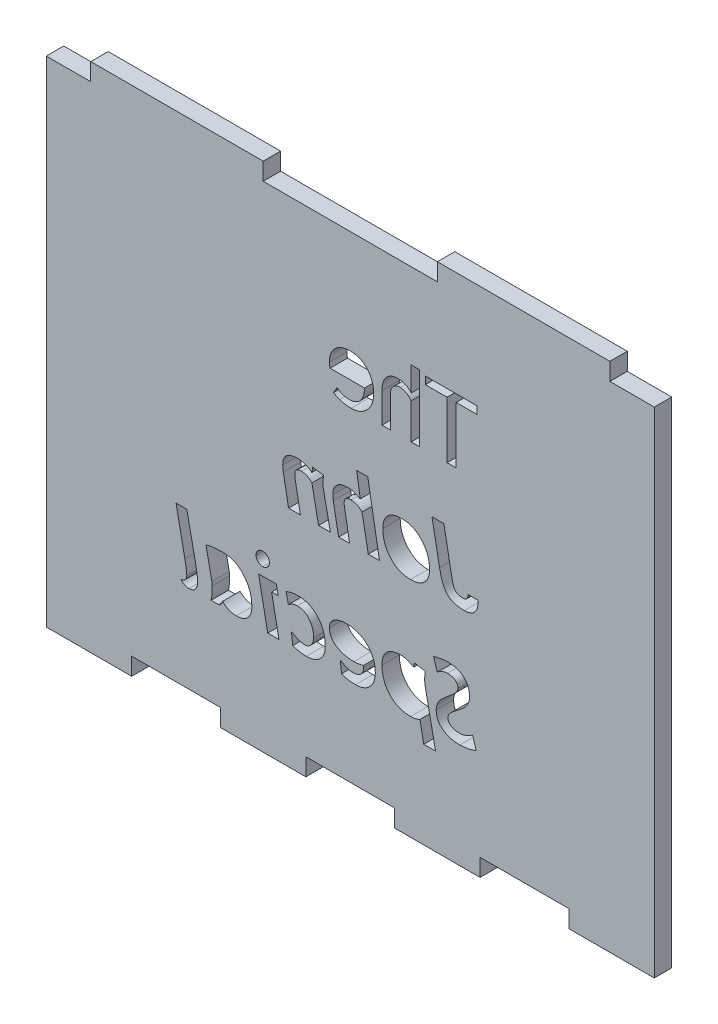
from build123d import *

# Parameters (mm, degrees)
SKETCH1_W           = 88.646
SKETCH1_H           = 72.10044
BOSS_EXTRUDE1_DEPTH = 2.54
SKETCH2_W           = 25.146
SKETCH2_H           = 2.54
BOSS_EXTRUDE2_DEPTH = 2.54
CUT_EXTRUDE2_DEPTH  = 59.823337279
SKETCH4_W           = 12.954
SKETCH4_H           = 2.54
CUT_EXTRUDE3_DEPTH  = 59.823337424


with BuildPart() as part:
    # Sketch1 → Boss-Extrude1 (new body)
    with BuildSketch(Plane.XY):
        Rectangle(SKETCH1_W, SKETCH1_H)
    extrude(amount=BOSS_EXTRUDE1_DEPTH)

    # Sketch2 → Boss-Extrude2 (add)
    with BuildSketch(Plane.XY.offset(2.54)):
        with Locations((-25.273, 37.32022)):
            Rectangle(SKETCH2_W, SKETCH2_H)
    boss_extrude2 = extrude(amount=-BOSS_EXTRUDE2_DEPTH)

    # Mirror1: Boss-Extrude2 across plane
    add(boss_extrude2.mirror(Plane(origin=(0, 0, 0), x_dir=(0, 0, 1), z_dir=(1, 0, 0))))

    # Sketch3 → Cut-Extrude2 (cut, through all)
    with BuildSketch(Plane.XY.offset(2.54)):
        Polygon((14.104876681, 22.18900854), (14.104876681, 13.919705577), (15.442558043, 13.919705577), (15.442558043, 22.18900854), (18.482742955, 22.18900854), (18.482742955, 23.283475108), (10.943084372, 23.283475108), (10.943084372, 22.18900854), align=None)
        with BuildLine():
            Line((5.835573718, 13.919705577), (5.835573718, 18.314672892))
            add(Edge.make_bspline(
                [(5.835573718, 18.314672892), (5.836362308, 18.378708239), (5.83789641, 18.503280928), (5.858548865, 18.683978046), (5.885653799, 18.85459901), (5.927433082, 19.015065676), (5.983160084, 19.164451126), (6.046777802, 19.305072864), (6.12611402, 19.432813957), (6.215110339, 19.551155249), (6.315356264, 19.657470477), (6.426179014, 19.749775903), (6.547879834, 19.825601856), (6.676888941, 19.891261656), (6.816811321, 19.940670281), (6.966735255, 19.974391095), (7.125789443, 19.995492988), (7.23525893, 19.998528179), (7.291062245, 20.000075403)],
                knots=[0, 0, 0, 0, 1.217326951, 2.368155965, 3.45549898, 4.501615449, 5.515462232, 6.485635617, 7.431953284, 8.369255628, 9.298158478, 10.205162655, 11.104210853, 12.02013242, 12.953710986, 13.918107468, 14.938731615, 16, 16, 16, 16], degree=3))
            add(Edge.make_bspline(
                [(7.291062245, 20.000075403), (7.366089526, 19.996682416), (7.51710226, 19.98985311), (7.74294756, 19.936456483), (7.969805669, 19.855814975), (8.189320046, 19.738965221), (8.398068724, 19.605839765), (8.582190892, 19.454102084), (8.745445666, 19.295703429), (8.832919183, 19.176701843), (8.875758631, 19.118421778)],
                knots=[0, 0, 0, 0, 0.958454268, 1.929148958, 2.953916839, 4.029739456, 5.101285646, 6.114466583, 7.07657524, 8, 8, 8, 8], degree=3))
            Line((8.875758631, 19.118421778), (8.875758631, 13.919705577))
            Line((8.875758631, 13.919705577), (10.091832596, 13.919705577))
            Line((10.091832596, 13.919705577), (10.091832596, 23.648297298))
            Line((10.091832596, 23.648297298), (8.875758631, 23.648297298))
            Line((8.875758631, 23.648297298), (8.875758631, 20.087480719))
            add(Edge.make_bspline(
                [(8.875758631, 20.087480719), (8.831068631, 20.150193387), (8.738883899, 20.279554552), (8.552701038, 20.442445841), (8.335705593, 20.594990704), (8.084684384, 20.725889009), (7.813367346, 20.834421409), (7.532835269, 20.915008337), (7.247859474, 20.964580127), (7.05627517, 20.970148967), (6.960442136, 20.972934575)],
                knots=[0, 0, 0, 0, 0.842545064, 1.737968014, 2.696361244, 3.750476918, 4.836026527, 5.898724637, 6.948913928, 8, 8, 8, 8], degree=3))
            add(Edge.make_bspline(
                [(6.960442136, 20.972934575), (6.871662663, 20.970823178), (6.69785184, 20.966689525), (6.444411307, 20.932100006), (6.20599224, 20.874740271), (5.981174862, 20.797896951), (5.773758063, 20.693598528), (5.578980968, 20.570204118), (5.402605115, 20.419638036), (5.238063226, 20.250990373), (5.093078604, 20.060598866), (4.964140409, 19.854617459), (4.858015493, 19.630339056), (4.770812827, 19.390385718), (4.702402115, 19.13414168), (4.653023754, 18.861612337), (4.624721466, 18.571793088), (4.621270889, 18.373005367), (4.619499753, 18.270970234)],
                knots=[0, 0, 0, 0, 1.053191455, 2.061918906, 3.028084458, 3.959873822, 4.87412947, 5.776850956, 6.689127291, 7.619308735, 8.567891154, 9.523119962, 10.498016104, 11.506155383, 12.54899793, 13.641391598, 14.789357204, 16, 16, 16, 16], degree=3))
            Line((4.619499753, 18.270970234), (4.619499753, 13.919705577))
            Line((4.619499753, 13.919705577), (5.835573718, 13.919705577))
        make_face()
        with BuildLine():
            Line((-2.944860333, 17.324712679), (2.065744427, 17.324712679))
            add(Edge.make_bspline(
                [(2.065744427, 17.324712679), (2.063322323, 17.221406405), (2.058615861, 17.02066887), (2.028958286, 16.728744414), (1.975936938, 16.455915032), (1.901141196, 16.201866128), (1.808845557, 15.964006626), (1.692776214, 15.745385016), (1.555315104, 15.544690723), (1.447125454, 15.426572953), (1.393103515, 15.367593642)],
                knots=[0, 0, 0, 0, 1.167775368, 2.269139511, 3.312377417, 4.304673693, 5.259241788, 6.191231847, 7.096834467, 8, 8, 8, 8], degree=3))
            add(Edge.make_bspline(
                [(1.393103515, 15.367593642), (1.342940099, 15.319368143), (1.243664047, 15.223927333), (1.075641972, 15.105356198), (0.90060496, 15.000699498), (0.713047741, 14.918248633), (0.516633284, 14.849712132), (0.308340567, 14.80619936), (0.090513912, 14.775866877), (-0.05847304, 14.772617458), (-0.134589404, 14.770957353)],
                knots=[0, 0, 0, 0, 0.989843858, 1.958953311, 2.921404456, 3.890597899, 4.872059572, 5.879024385, 6.91640879, 8, 8, 8, 8], degree=3))
            add(Edge.make_bspline(
                [(-0.134589404, 14.770957353), (-0.221444369, 14.772695449), (-0.39183749, 14.776105267), (-0.642198414, 14.805519616), (-0.881942849, 14.852433254), (-1.110945577, 14.919056381), (-1.328618175, 15.004713501), (-1.534666626, 15.109800769), (-1.730329424, 15.233579974), (-1.850634342, 15.330302773), (-1.911197462, 15.378994335)],
                knots=[0, 0, 0, 0, 1.086166282, 2.13085413, 3.148605832, 4.138974104, 5.110011886, 6.070258581, 7.028542114, 8, 8, 8, 8], degree=3))
            Line((-1.911197462, 15.378994335), (-2.433729244, 14.52774256))
            add(Edge.make_bspline(
                [(-2.433729244, 14.52774256), (-2.380465873, 14.482358792), (-2.266972787, 14.385655492), (-2.059366097, 14.267725142), (-1.818315449, 14.152101603), (-1.640247826, 14.090754558), (-1.546375273, 14.058414014)],
                knots=[0, 0, 0, 0, 0.829008863, 1.766444218, 2.822528312, 4, 4, 4, 4], degree=3))
            add(Edge.make_bspline(
                [(-1.546375273, 14.058414014), (-1.419087854, 14.017963617), (-1.159949534, 13.935612605), (-0.751645761, 13.856307499), (-0.322598515, 13.808321355), (-0.02958203, 13.801553636), (0.120026082, 13.798098181)],
                knots=[0, 0, 0, 0, 0.945414737, 1.92472428, 2.940407449, 4, 4, 4, 4], degree=3))
            add(Edge.make_bspline(
                [(0.120026082, 13.798098181), (0.228468133, 13.800451561), (0.442384924, 13.805093925), (0.756782726, 13.847924638), (1.058278221, 13.918228578), (1.346988274, 14.015973928), (1.624013493, 14.139143341), (1.887498397, 14.293075156), (2.139612383, 14.473026688), (2.293809305, 14.612920115), (2.371663033, 14.683552036)],
                knots=[0, 0, 0, 0, 1.048227686, 2.067772609, 3.061680434, 4.037860413, 5.011115386, 5.988102045, 6.984196606, 8, 8, 8, 8], degree=3))
            add(Edge.make_bspline(
                [(2.371663033, 14.683552036), (2.453989406, 14.766726487), (2.617744799, 14.932168791), (2.828991929, 15.209543538), (3.006999118, 15.508116685), (3.151254945, 15.827908228), (3.266814947, 16.167316383), (3.344379601, 16.52896047), (3.396368982, 16.910241015), (3.401037825, 17.171887664), (3.403425788, 17.305711524)],
                knots=[0, 0, 0, 0, 0.967481273, 1.924417048, 2.876158889, 3.837660968, 4.822011602, 5.836599495, 6.893490101, 8, 8, 8, 8], degree=3))
            add(Edge.make_bspline(
                [(3.403425788, 17.305711524), (3.400122819, 17.444568414), (3.393646084, 17.716850539), (3.343502649, 18.114357717), (3.262101762, 18.491011676), (3.148440256, 18.846848064), (2.999209225, 19.180961977), (2.818124751, 19.493868291), (2.604245303, 19.786719135), (2.437065683, 19.961325214), (2.352661878, 20.049478407)],
                knots=[0, 0, 0, 0, 1.103286409, 2.163415646, 3.178379871, 4.162134233, 5.126549343, 6.08055717, 7.030932849, 8, 8, 8, 8], degree=3))
            add(Edge.make_bspline(
                [(2.352661878, 20.049478407), (2.273489747, 20.123143937), (2.117771475, 20.26803165), (1.8656027, 20.457338832), (1.601216788, 20.615434747), (1.327765436, 20.74782069), (1.042101387, 20.848720104), (0.746309332, 20.921613066), (0.439169408, 20.963365838), (0.23098784, 20.969721171), (0.125726429, 20.972934575)],
                knots=[0, 0, 0, 0, 1.047961233, 2.061163597, 3.050032296, 4.030553054, 5.001664552, 5.981646773, 6.979473968, 8, 8, 8, 8], degree=3))
            add(Edge.make_bspline(
                [(0.125726429, 20.972934575), (0.004658122, 20.970312015), (-0.231760674, 20.965190754), (-0.576417296, 20.927348685), (-0.901182373, 20.862573871), (-1.206050174, 20.773676373), (-1.491418226, 20.660035634), (-1.755363968, 20.517866427), (-2.000624519, 20.351519377), (-2.146339335, 20.219720758), (-2.219016185, 20.153984764)],
                knots=[0, 0, 0, 0, 1.140665541, 2.227459699, 3.262123076, 4.257359294, 5.215990926, 6.15052194, 7.077552707, 8, 8, 8, 8], degree=3))
            add(Edge.make_bspline(
                [(-2.219016185, 20.153984764), (-2.284508385, 20.086924037), (-2.414489159, 19.953830246), (-2.582121965, 19.730864923), (-2.725890129, 19.492590728), (-2.841877811, 19.236669625), (-2.930912983, 18.965019337), (-2.996001444, 18.678249624), (-3.033957822, 18.375229162), (-3.039127144, 18.167837016), (-3.041766227, 18.061957521)],
                knots=[0, 0, 0, 0, 0.971813225, 1.928734025, 2.886782605, 3.854408881, 4.837446585, 5.848277975, 6.901485685, 8, 8, 8, 8], degree=3))
            add(Edge.make_bspline(
                [(-3.041766227, 18.061957521), (-3.040903864, 17.996662997), (-3.039208764, 17.868317044), (-3.018957194, 17.67990448), (-2.989736724, 17.498721883), (-2.959675842, 17.382160147), (-2.944860333, 17.324712679)],
                knots=[0, 0, 0, 0, 1.050108016, 2.064141145, 3.045911693, 4, 4, 4, 4], degree=3))
        make_face()
        with BuildLine():
            Line((18.604350352, -1.186752418), (17.145061594, -1.186752418))
            add(Edge.make_bspline(
                [(17.145061594, -1.186752418), (17.144202802, -1.253352056), (17.142590226, -1.378407863), (17.115270751, -1.553752109), (17.064393782, -1.702915296), (16.99161821, -1.826382933), (16.895599971, -1.923709547), (16.775735542, -1.99084827), (16.635251487, -2.031560669), (16.534786134, -2.035782609), (16.48192126, -2.038004194)],
                knots=[0, 0, 0, 0, 1.292464177, 2.426892338, 3.430551388, 4.335519597, 5.187884164, 6.052934473, 6.975454011, 8, 8, 8, 8], degree=3))
            add(Edge.make_bspline(
                [(16.48192126, -2.038004194), (16.398807005, -2.036053567), (16.238786424, -2.032298009), (16.010178361, -1.997200716), (15.801748043, -1.943719305), (15.615472625, -1.863085255), (15.450712124, -1.760060245), (15.306615442, -1.634986838), (15.188527593, -1.484639096), (15.108074629, -1.339975683), (15.050695712, -1.204834848), (15.008021364, -1.077533886), (14.965039772, -0.926950878), (14.919165856, -0.754213844), (14.873636688, -0.557762094), (14.829105437, -0.33759865), (14.780661121, -0.094028095), (14.751156459, 0.076751525), (14.73571505, 0.166129868)],
                knots=[0, 0, 0, 0, 1.252259218, 2.410985335, 3.478834076, 4.48820965, 5.457914, 6.39845156, 7.349929615, 8.324745482, 8.885228559, 9.561674695, 10.347384596, 11.246077296, 12.255994768, 13.38716425, 14.632559721, 16, 16, 16, 16], degree=3))
            Line((14.73571505, 0.166129868), (13.65074906, 5.988083976))
            Line((13.65074906, 5.988083976), (11.915943544, 5.988083976))
            Line((11.915943544, 5.988083976), (13.010410112, 0.137628135))
            add(Edge.make_bspline(
                [(13.010410112, 0.137628135), (13.044012547, -0.038224236), (13.108644996, -0.376466679), (13.231440239, -0.856598647), (13.362352343, -1.292274825), (13.510501666, -1.68081987), (13.670450383, -2.024426586), (13.845373247, -2.321588854), (14.03317365, -2.573682703), (14.238991022, -2.782261324), (14.4639257, -2.953212339), (14.708038944, -3.098369908), (14.972756466, -3.222121737), (15.260161154, -3.322218085), (15.568687795, -3.403029223), (15.900947181, -3.455814036), (16.254400693, -3.491391996), (16.49766128, -3.495291361), (16.622529812, -3.497292952)],
                knots=[0, 0, 0, 0, 1.492757487, 2.871237612, 4.131050578, 5.284690296, 6.336157298, 7.288249881, 8.155585261, 8.951158932, 9.723456004, 10.505232554, 11.315763461, 12.156090819, 13.0400904, 13.97186286, 14.958933257, 16, 16, 16, 16], degree=3))
            add(Edge.make_bspline(
                [(16.622529812, -3.497292952), (16.696065136, -3.495911177), (16.839704272, -3.493212107), (17.048742964, -3.469979819), (17.246813862, -3.432682983), (17.432638943, -3.376779847), (17.608656321, -3.308815959), (17.773622809, -3.225159971), (17.925399366, -3.123507505), (18.066359312, -3.009491935), (18.194808706, -2.883302887), (18.302223659, -2.740766561), (18.396982612, -2.59029515), (18.472988852, -2.427444925), (18.53229671, -2.253499741), (18.572928281, -2.067952897), (18.601360704, -1.871667902), (18.603337942, -1.736626977), (18.604350352, -1.667481657)],
                knots=[0, 0, 0, 0, 1.157682452, 2.26134187, 3.307861428, 4.32722154, 5.31258924, 6.276109338, 7.233258558, 8.183470878, 9.128539216, 10.060196387, 10.987411591, 11.924392561, 12.883255196, 13.875314004, 14.912092066, 16, 16, 16, 16], degree=3))
            add(Edge.make_bspline(
                [(18.604350352, -1.667481657), (18.604350352, -1.594643894), (18.604350352, -1.434400814), (18.604350352, -1.274157734), (18.604350352, -1.186752418)],
                knots=[0, 0, 0, 0, 0.909090909, 2, 2, 2, 2], degree=3))
        make_face()
        with BuildLine():
            add(Edge.make_bspline(
                [(11.551121354, -0.823830344), (11.548385741, -0.672884566), (11.543010228, -0.376274374), (11.484383378, 0.058064972), (11.399218228, 0.476069975), (11.272305873, 0.874970302), (11.113654252, 1.258132311), (10.913098305, 1.619330476), (10.683126973, 1.966596756), (10.416164064, 2.289735829), (10.125225725, 2.587443028), (9.808703631, 2.84612144), (9.473707691, 3.065361326), (9.119675212, 3.245579457), (8.746765246, 3.385224563), (8.354659198, 3.482843179), (7.944255539, 3.546621064), (7.663728648, 3.552794536), (7.520976229, 3.555936046)],
                knots=[0, 0, 0, 0, 1.089260158, 2.140408765, 3.159376078, 4.166117984, 5.158209807, 6.148824705, 7.144557244, 8.161726846, 9.17073084, 10.145745869, 11.1072705, 12.056314662, 13.008582141, 13.975832636, 14.969956907, 16, 16, 16, 16], degree=3))
            add(Edge.make_bspline(
                [(7.520976229, 3.555936046), (7.412598323, 3.553556326), (7.202371094, 3.548940239), (6.896047726, 3.518734096), (6.608882842, 3.46689903), (6.341336136, 3.389122176), (6.090996568, 3.296215947), (5.861591838, 3.176881292), (5.651007966, 3.037806763), (5.460572677, 2.877624207), (5.29003442, 2.698560192), (5.143296517, 2.498734194), (5.016819093, 2.282125294), (4.917118649, 2.045812759), (4.835511034, 1.793850082), (4.78284031, 1.522634913), (4.74691108, 1.234323746), (4.743078678, 1.035868998), (4.74110715, 0.933776559)],
                knots=[0, 0, 0, 0, 1.195427806, 2.318844146, 3.391790497, 4.409041197, 5.388672984, 6.332342876, 7.254694043, 8.167122162, 9.071517264, 9.975588481, 10.895899955, 11.831622464, 12.799398629, 13.811960128, 14.874391626, 16, 16, 16, 16], degree=3))
            add(Edge.make_bspline(
                [(4.74110715, 0.933776559), (4.744193739, 0.780355225), (4.75027144, 0.478258316), (4.804111692, 0.034894448), (4.894888134, -0.389065477), (5.014041894, -0.795826209), (5.176556372, -1.181381096), (5.369864135, -1.550146129), (5.601677622, -1.898511746), (5.863612853, -2.226054864), (6.155213472, -2.523299183), (6.468745095, -2.785166629), (6.804078018, -3.005787863), (7.160700599, -3.185320518), (7.537556752, -3.32705856), (7.935776793, -3.424051186), (8.353043591, -3.488201121), (8.638628843, -3.494218353), (8.784553084, -3.497292952)],
                knots=[0, 0, 0, 0, 1.096689366, 2.159455004, 3.187097923, 4.194301232, 5.185029339, 6.173612617, 7.167131368, 8.172143384, 9.168084663, 10.139307146, 11.087622835, 12.031407793, 12.988656347, 13.959604279, 14.957427965, 16, 16, 16, 16], degree=3))
            add(Edge.make_bspline(
                [(8.784553084, -3.497292952), (8.890419328, -3.495102972), (9.096959592, -3.49083042), (9.397988532, -3.457633652), (9.682052336, -3.406209642), (9.946603771, -3.328902726), (10.195093019, -3.235199012), (10.422568905, -3.114170643), (10.634354812, -2.974934198), (10.826698809, -2.813283132), (10.997423194, -2.630285183), (11.148331502, -2.429591996), (11.271009664, -2.206550921), (11.374010351, -1.966778964), (11.454277402, -1.707600434), (11.510062419, -1.430022093), (11.545186353, -1.133180703), (11.549102232, -0.929073155), (11.551121354, -0.823830344)],
                knots=[0, 0, 0, 0, 1.15986297, 2.262840289, 3.315122785, 4.319047884, 5.279315768, 6.220019462, 7.136337693, 8.052577059, 8.965920009, 9.873787376, 10.796706201, 11.748179476, 12.729488124, 13.764017974, 14.847073337, 16, 16, 16, 16], degree=3))
        make_face()
        with BuildLine():
            Line((-2.485032365, 0.825469971), (-1.704084865, -3.375685555))
            Line((-1.704084865, -3.375685555), (-0.085186399, -3.375685555))
            Line((-0.085186399, -3.375685555), (-0.858533436, 0.880573323))
            add(Edge.make_bspline(
                [(-0.858533436, 0.880573323), (-0.868825883, 0.949487145), (-0.889431209, 1.087451604), (-0.892899678, 1.226903527), (-0.894635632, 1.296698633)],
                knots=[0, 0, 0, 0, 0.999008345, 2, 2, 2, 2], degree=3))
            add(Edge.make_bspline(
                [(-0.894635632, 1.296698633), (-0.892372943, 1.369235889), (-0.888107766, 1.505968873), (-0.839128256, 1.696943508), (-0.761959872, 1.860475812), (-0.649705799, 1.994922986), (-0.504507406, 2.096896554), (-0.328983475, 2.169775001), (-0.122419374, 2.209731859), (0.024849711, 2.215301771), (0.102925042, 2.218254684)],
                knots=[0, 0, 0, 0, 1.116517596, 2.104639605, 3.017859051, 3.884749283, 4.774032793, 5.728496015, 6.795752503, 8, 8, 8, 8], degree=3))
            add(Edge.make_bspline(
                [(0.102925042, 2.218254684), (0.177172417, 2.21615305), (0.323937574, 2.21199874), (0.541067896, 2.175984436), (0.752190229, 2.119742498), (0.957395747, 2.038161143), (1.158140555, 1.935828326), (1.351218193, 1.806754305), (1.541250471, 1.658784521), (1.658258091, 1.544886866), (1.718023277, 1.48671019)],
                knots=[0, 0, 0, 0, 0.977050954, 1.931341498, 2.890285373, 3.848939076, 4.833648286, 5.851424112, 6.902549792, 8, 8, 8, 8], degree=3))
            Line((1.718023277, 1.48671019), (2.622478289, -3.375685555))
            Line((2.622478289, -3.375685555), (4.254677564, -3.375685555))
            Line((4.254677564, -3.375685555), (2.552174013, 6.352906166))
            Line((2.552174013, 6.352906166), (0.9275752, 6.352906166))
            Line((0.9275752, 6.352906166), (1.450106982, 3.010602877))
            add(Edge.make_bspline(
                [(1.450106982, 3.010602877), (1.377093256, 3.053846434), (1.232659845, 3.13938945), (1.010105122, 3.252390422), (0.783026114, 3.345687445), (0.552767262, 3.420856917), (0.320472487, 3.483708474), (0.084297357, 3.52348339), (-0.154125868, 3.552741728), (-0.314374733, 3.554867682), (-0.394905237, 3.555936046)],
                knots=[0, 0, 0, 0, 1.044478737, 2.066154332, 3.069577818, 4.06322969, 5.046642051, 6.028569642, 7.009289202, 8, 8, 8, 8], degree=3))
            add(Edge.make_bspline(
                [(-0.394905237, 3.555936046), (-0.476691382, 3.554872787), (-0.636925474, 3.552789668), (-0.869988619, 3.524972518), (-1.089691646, 3.483262837), (-1.296260007, 3.428018176), (-1.487276603, 3.349788817), (-1.666826718, 3.260051685), (-1.831471355, 3.150285147), (-1.981972157, 3.024886557), (-2.116288459, 2.884078902), (-2.236264091, 2.731340179), (-2.33506908, 2.562962356), (-2.414461563, 2.381389267), (-2.477897418, 2.187394503), (-2.523026012, 1.980565676), (-2.549831237, 1.759761868), (-2.553464745, 1.608393943), (-2.555336641, 1.530412848)],
                knots=[0, 0, 0, 0, 1.167940078, 2.288209315, 3.3477681, 4.362114127, 5.336769684, 6.291904694, 7.225578127, 8.157144141, 9.085187154, 10.001105912, 10.926099561, 11.866066903, 12.827610853, 13.837628358, 14.885998412, 16, 16, 16, 16], degree=3))
            add(Edge.make_bspline(
                [(-2.555336641, 1.530412848), (-2.552200609, 1.416788405), (-2.545669497, 1.180153676), (-2.505772235, 0.946783328), (-2.485032365, 0.825469971)],
                knots=[0, 0, 0, 0, 0.96033615, 2, 2, 2, 2], degree=3))
        make_face()
        with BuildLine():
            Line((-9.000528656, -3.375685555), (-7.277123833, -3.375685555))
            Line((-7.277123833, -3.375685555), (-8.008668328, 0.63735853))
            add(Edge.make_bspline(
                [(-8.008668328, 0.63735853), (-8.021680104, 0.71457067), (-8.046480711, 0.861737965), (-8.076667384, 1.073730727), (-8.091627241, 1.266709766), (-8.094650208, 1.38915262), (-8.096073644, 1.446807763)],
                knots=[0, 0, 0, 0, 1.15271283, 2.197084913, 3.151054369, 4, 4, 4, 4], degree=3))
            add(Edge.make_bspline(
                [(-8.096073644, 1.446807763), (-8.09339202, 1.507242086), (-8.088280125, 1.62244613), (-8.043422085, 1.78437985), (-7.961648591, 1.920236861), (-7.851581189, 2.033658964), (-7.707057529, 2.117374711), (-7.535165225, 2.177803507), (-7.332388084, 2.213310373), (-7.187334391, 2.216534072), (-7.109913663, 2.218254684)],
                knots=[0, 0, 0, 0, 1.01423625, 1.933406551, 2.787275926, 3.652403866, 4.559177506, 5.565347241, 6.700532301, 8, 8, 8, 8], degree=3))
            add(Edge.make_bspline(
                [(-7.109913663, 2.218254684), (-7.040772607, 2.215857289), (-6.903011727, 2.211080571), (-6.698541864, 2.178905132), (-6.500243894, 2.120654368), (-6.307466944, 2.042206446), (-6.119092803, 1.943351591), (-5.939214922, 1.817423994), (-5.76075633, 1.673815005), (-5.651454289, 1.562615211), (-5.595521554, 1.505711345)],
                knots=[0, 0, 0, 0, 0.963101091, 1.918941656, 2.873886057, 3.835571803, 4.814345183, 5.82988357, 6.889494223, 8, 8, 8, 8], degree=3))
            Line((-5.595521554, 1.505711345), (-4.622662381, -3.375685555))
            Line((-4.622662381, -3.375685555), (-2.891657097, -3.375685555))
            Line((-2.891657097, -3.375685555), (-3.96712251, 1.792628796))
            add(Edge.make_bspline(
                [(-3.96712251, 1.792628796), (-3.975181127, 1.846375304), (-3.993683094, 1.969773167), (-3.994923885, 2.094595856), (-3.995624243, 2.165051448)],
                knots=[0, 0, 0, 0, 0.871109215, 2, 2, 2, 2], degree=3))
            add(Edge.make_bspline(
                [(-3.995624243, 2.165051448), (-3.994438775, 2.256277836), (-3.992024707, 2.442049719), (-3.97479083, 2.72486181), (-3.943477275, 3.016188915), (-3.916331956, 3.212715319), (-3.90251858, 3.312721253)],
                knots=[0, 0, 0, 0, 0.949875881, 1.934311288, 2.948837787, 4, 4, 4, 4], degree=3))
            Line((-3.90251858, 3.312721253), (-5.473914157, 3.555936046))
            Line((-5.473914157, 3.555936046), (-5.595521554, 2.826291667))
            add(Edge.make_bspline(
                [(-5.595521554, 2.826291667), (-5.667190122, 2.884891065), (-5.810338807, 3.001935776), (-6.045548091, 3.148537461), (-6.292215209, 3.275906452), (-6.553489211, 3.378070065), (-6.828216406, 3.4581301), (-7.116271967, 3.51463987), (-7.41749621, 3.549713136), (-7.622847416, 3.553835934), (-7.727451224, 3.555936046)],
                knots=[0, 0, 0, 0, 0.963962068, 1.925389414, 2.8819094, 3.853974023, 4.844137001, 5.860382792, 6.910100844, 8, 8, 8, 8], degree=3))
            add(Edge.make_bspline(
                [(-7.727451224, 3.555936046), (-7.813020877, 3.554627381), (-7.979412469, 3.552082661), (-8.220464572, 3.528163173), (-8.44590092, 3.49404782), (-8.654276124, 3.440071529), (-8.845876062, 3.372433656), (-9.021317726, 3.290209707), (-9.179967032, 3.192687108), (-9.323598409, 3.081238321), (-9.448062142, 2.951549182), (-9.55728483, 2.808591065), (-9.649021617, 2.649485064), (-9.722265915, 2.475406259), (-9.782384723, 2.287451403), (-9.822844165, 2.084143673), (-9.848253933, 1.866116942), (-9.850580933, 1.716066127), (-9.851780431, 1.638719435)],
                knots=[0, 0, 0, 0, 1.251517357, 2.433595992, 3.541118798, 4.583952726, 5.577537257, 6.510184215, 7.412888828, 8.297141495, 9.162151904, 10.03506753, 10.923534292, 11.840957886, 12.793419114, 13.80566816, 14.868887792, 16, 16, 16, 16], degree=3))
            add(Edge.make_bspline(
                [(-9.851780431, 1.638719435), (-9.85038548, 1.577263807), (-9.847462545, 1.448491676), (-9.83247055, 1.24728828), (-9.802716458, 1.03077414), (-9.777460604, 0.88177019), (-9.764375115, 0.8045687)],
                knots=[0, 0, 0, 0, 0.878329418, 1.840422978, 2.881086277, 4, 4, 4, 4], degree=3))
            Line((-9.764375115, 0.8045687), (-9.000528656, -3.375685555))
        make_face()
        with BuildLine():
            add(Edge.make_bspline(
                [(12.672189541, -13.2530255), (12.7329611, -13.204628334), (12.851605492, -13.110142483), (13.03667177, -12.986631778), (13.221641134, -12.880859632), (13.408505986, -12.794799389), (13.596271755, -12.728443713), (13.784364596, -12.680134259), (13.973453141, -12.65047827), (14.100338944, -12.646818405), (14.163780264, -12.644988518)],
                knots=[0, 0, 0, 0, 1.133835457, 2.213588423, 3.244729749, 4.241933598, 5.212939244, 6.148192762, 7.07411947, 8, 8, 8, 8], degree=3))
            add(Edge.make_bspline(
                [(14.163780264, -12.644988518), (14.22525657, -12.645322614), (14.344616658, -12.645971283), (14.517099434, -12.662210532), (14.677521629, -12.684940054), (14.826836526, -12.713836074), (14.963526436, -12.756693903), (15.089977695, -12.80539798), (15.204481404, -12.863950466), (15.306325023, -12.933179019), (15.395881594, -13.010832515), (15.47354362, -13.098484241), (15.539850951, -13.194579059), (15.593343134, -13.300909445), (15.635626323, -13.414870983), (15.663025544, -13.538977997), (15.6833472, -13.671019229), (15.684951912, -13.76280466), (15.685772836, -13.809759363)],
                knots=[0, 0, 0, 0, 1.348400188, 2.618003204, 3.79729431, 4.903916575, 5.950249029, 6.936131378, 7.874740588, 8.765194314, 9.632015617, 10.468790778, 11.328451844, 12.186200925, 13.074374078, 13.987954761, 14.97069735, 16, 16, 16, 16], degree=3))
            add(Edge.make_bspline(
                [(15.685772836, -13.809759363), (15.682925392, -13.85245244), (15.677041331, -13.94067494), (15.635679193, -14.074733697), (15.569872244, -14.213238394), (15.479422765, -14.358613289), (15.362133323, -14.508139131), (15.220073387, -14.664444377), (15.053647079, -14.827418236), (14.929587128, -14.932867377), (14.864922909, -14.987831016)],
                knots=[0, 0, 0, 0, 0.694159026, 1.434435008, 2.264250846, 3.185048469, 4.213538291, 5.351707008, 6.619620628, 8, 8, 8, 8], degree=3))
            Line((14.864922909, -14.987831016), (13.895863968, -15.806780827))
            add(Edge.make_bspline(
                [(13.895863968, -15.806780827), (13.826821752, -15.865671103), (13.699711992, -15.974090695), (13.525602882, -16.122839941), (13.389512372, -16.249795587), (13.276450955, -16.352796307), (13.18291269, -16.455991662), (13.09149107, -16.567280111), (13.001096788, -16.698285608), (12.876023036, -16.88944402), (12.735385776, -17.141419079), (12.61512745, -17.458201635), (12.538562569, -17.779270365), (12.528833878, -17.995933724), (12.523980526, -18.104020552)],
                knots=[0, 0, 0, 0, 1.177429256, 2.167699123, 2.970327547, 3.592312329, 4.150619554, 4.775636842, 5.459618235, 6.214064608, 7.740178498, 9.191540945, 10.598944324, 12, 12, 12, 12], degree=3))
            add(Edge.make_bspline(
                [(12.523980526, -18.104020552), (12.526677633, -18.206826601), (12.531950018, -18.407794926), (12.579654854, -18.699954969), (12.651527082, -18.976020918), (12.760839059, -19.232558614), (12.894840249, -19.473966351), (13.063366358, -19.695993305), (13.259247068, -19.902570277), (13.486650398, -20.086934228), (13.734881979, -20.25439398), (14.003871318, -20.398580523), (14.29004584, -20.520574683), (14.594216476, -20.619285603), (14.915768112, -20.696490825), (15.255209836, -20.754372607), (15.612969984, -20.785768445), (15.857359794, -20.790345953), (15.982190865, -20.792684084)],
                knots=[0, 0, 0, 0, 1.00077582, 1.956346353, 2.876851455, 3.772941739, 4.665306857, 5.559972767, 6.480808674, 7.431986673, 8.405711314, 9.394027309, 10.400266086, 11.432446331, 12.505442427, 13.619211324, 14.783924749, 16, 16, 16, 16], degree=3))
            add(Edge.make_bspline(
                [(15.982190865, -20.792684084), (16.086740162, -20.791255303), (16.294188857, -20.78842029), (16.603020735, -20.764716907), (16.906853319, -20.727198534), (17.206733466, -20.673365596), (17.502452232, -20.605571851), (17.793989729, -20.5212053), (18.081168377, -20.423502823), (18.267813775, -20.345337018), (18.361135559, -20.306254498)],
                knots=[0, 0, 0, 0, 1.02600741, 2.035823327, 3.038187761, 4.02956232, 5.024807818, 6.014465778, 7.00724262, 8, 8, 8, 8], degree=3))
            Line((18.361135559, -20.306254498), (17.821502737, -18.603750947))
            add(Edge.make_bspline(
                [(17.821502737, -18.603750947), (17.748996341, -18.662053378), (17.605809444, -18.777190035), (17.376025292, -18.925852106), (17.138124616, -19.05153731), (16.891539075, -19.155027708), (16.635781779, -19.23510871), (16.371167395, -19.291636351), (16.098423481, -19.327026109), (15.913894159, -19.331257754), (15.820681041, -19.333395326)],
                knots=[0, 0, 0, 0, 1.025794438, 2.02575676, 3.013365359, 3.990439165, 4.971576287, 5.965098467, 6.972090103, 8, 8, 8, 8], degree=3))
            add(Edge.make_bspline(
                [(15.820681041, -19.333395326), (15.710912704, -19.329648896), (15.499501151, -19.322433348), (15.196285605, -19.270254413), (14.923087142, -19.177926246), (14.717170321, -19.072554832), (14.574889699, -18.967571748), (14.479572777, -18.884414056), (14.402120924, -18.790636633), (14.337568776, -18.690070677), (14.289024393, -18.581539008), (14.251544797, -18.465862175), (14.23129879, -18.342241889), (14.228106394, -18.257361769), (14.226484078, -18.214227255)],
                knots=[0, 0, 0, 0, 1.812012267, 3.489898261, 5.057273228, 6.558733917, 7.28447051, 7.973099672, 8.641177715, 9.285172158, 9.940276577, 10.598378439, 11.28772174, 12, 12, 12, 12], degree=3))
            add(Edge.make_bspline(
                [(14.226484078, -18.214227255), (14.229362111, -18.169031011), (14.235293493, -18.075885402), (14.275309566, -17.935641129), (14.342034958, -17.794085825), (14.432451996, -17.648629908), (14.54977867, -17.500299685), (14.693371761, -17.349110902), (14.860310289, -17.192874753), (14.984536308, -17.093573014), (15.04923412, -17.041855948)],
                knots=[0, 0, 0, 0, 0.734068962, 1.51285361, 2.350769121, 3.270192263, 4.289022369, 5.417311782, 6.654917253, 8, 8, 8, 8], degree=3))
            Line((15.04923412, -17.041855948), (16.058195487, -16.241907293))
            add(Edge.make_bspline(
                [(16.058195487, -16.241907293), (16.129296803, -16.1844719), (16.259508095, -16.079287676), (16.435300522, -15.932692866), (16.573643306, -15.811934739), (16.682957773, -15.71077821), (16.773368112, -15.612939429), (16.855741827, -15.502965636), (16.943879589, -15.379654785), (17.061600057, -15.194508697), (17.189595169, -14.945997751), (17.306507592, -14.634335889), (17.374560182, -14.311791401), (17.383697139, -14.093815079), (17.388276387, -13.984569995)],
                knots=[0, 0, 0, 0, 1.206545292, 2.209605003, 3.021298009, 3.630494632, 4.174914608, 4.776954827, 5.442733686, 6.175681511, 7.671435053, 9.123652272, 10.55843586, 12, 12, 12, 12], degree=3))
            add(Edge.make_bspline(
                [(17.388276387, -13.984569995), (17.385835001, -13.879929983), (17.381052017, -13.674926958), (17.340298737, -13.375825196), (17.274526081, -13.092877651), (17.180487158, -12.827662165), (17.063129805, -12.577801496), (16.915048157, -12.34757884), (16.74267457, -12.132066059), (16.543576106, -11.936049854), (16.323024638, -11.759447551), (16.085147931, -11.604962215), (15.83013735, -11.475279497), (15.559366103, -11.368123453), (15.271293928, -11.287292592), (14.967538867, -11.228647602), (14.647968409, -11.191411467), (14.429267547, -11.187629343), (14.317689625, -11.18569976)],
                knots=[0, 0, 0, 0, 1.071632831, 2.09946433, 3.086311774, 4.04267198, 4.977254909, 5.907909959, 6.840237509, 7.799213759, 8.763968345, 9.730488905, 10.699771859, 11.690260621, 12.709039785, 13.760202766, 14.857288811, 16, 16, 16, 16], degree=3))
            add(Edge.make_bspline(
                [(14.317689625, -11.18569976), (14.236581434, -11.187469228), (14.06337382, -11.191247951), (13.787731372, -11.213961537), (13.480245851, -11.247596497), (13.155482219, -11.29649532), (12.841160391, -11.348934362), (12.565640099, -11.409112334), (12.342330283, -11.472441915), (12.215139223, -11.526659182), (12.159158337, -11.550521949)],
                knots=[0, 0, 0, 0, 0.885030098, 1.889993462, 3.016452873, 4.259651073, 5.473084166, 6.492533301, 7.336515304, 8, 8, 8, 8], degree=3))
            Line((12.159158337, -11.550521949), (12.672189541, -13.2530255))
        make_face()
        with BuildLine():
            Line((10.165937103, -20.479165015), (10.699869579, -23.346439411))
            Line((10.699869579, -23.346439411), (12.432774979, -23.346439411))
            Line((12.432774979, -23.346439411), (10.925983332, -15.905586837))
            add(Edge.make_bspline(
                [(10.925983332, -15.905586837), (10.901598692, -15.767862421), (10.853073412, -15.493791693), (10.845931331, -15.215555179), (10.842378247, -15.077136448)],
                knots=[0, 0, 0, 0, 1.005028281, 2, 2, 2, 2], degree=3))
            add(Edge.make_bspline(
                [(10.842378247, -15.077136448), (10.8464438, -14.90129568), (10.854627071, -14.547357949), (10.913473565, -14.198242672), (10.943084372, -14.022572306)],
                knots=[0, 0, 0, 0, 0.993625449, 2, 2, 2, 2], degree=3))
            Line((10.943084372, -14.022572306), (9.362188217, -13.739455086))
            add(Edge.make_bspline(
                [(9.362188217, -13.739455086), (9.349657705, -13.780488998), (9.323077997, -13.867530083), (9.291118917, -14.010403632), (9.263270644, -14.172183239), (9.248376819, -14.287257697), (9.240580821, -14.347492069)],
                knots=[0, 0, 0, 0, 0.828806942, 1.758064305, 2.826485109, 4, 4, 4, 4], degree=3))
            add(Edge.make_bspline(
                [(9.240580821, -14.347492069), (9.165191882, -14.29896231), (9.017097067, -14.203629948), (8.788672579, -14.080833352), (8.561892816, -13.975125364), (8.335187215, -13.889302298), (8.108476, -13.822261707), (7.882261776, -13.774972726), (7.656691905, -13.744955094), (7.506499655, -13.741284067), (7.431670798, -13.739455086)],
                knots=[0, 0, 0, 0, 1.110973438, 2.18240776, 3.211619703, 4.210439591, 5.184263151, 6.138910046, 7.072766849, 8, 8, 8, 8], degree=3))
            add(Edge.make_bspline(
                [(7.431670798, -13.739455086), (7.318205533, -13.740803202), (7.097745634, -13.743422553), (6.778479927, -13.777204687), (6.480332928, -13.827377188), (6.204377103, -13.89832884), (5.951304987, -13.993243777), (5.717518581, -14.103518263), (5.50804862, -14.239874666), (5.318697282, -14.394876207), (5.15357497, -14.572532066), (5.009065155, -14.769796494), (4.89008017, -14.989328506), (4.787641747, -15.226993497), (4.713681828, -15.487326321), (4.657769953, -15.76675981), (4.626218752, -16.067009685), (4.621781013, -16.274139014), (4.619499753, -16.380615729)],
                knots=[0, 0, 0, 0, 1.230221709, 2.390287044, 3.477951276, 4.507751221, 5.475065482, 6.406080012, 7.305534244, 8.179005961, 9.053908426, 9.929242357, 10.824066976, 11.756828845, 12.730732069, 13.753357223, 14.845092847, 16, 16, 16, 16], degree=3))
            add(Edge.make_bspline(
                [(4.619499753, -16.380615729), (4.622288665, -16.538506786), (4.627761247, -16.848330786), (4.68532724, -17.301346318), (4.773075733, -17.732852719), (4.899022094, -18.142139319), (5.061656641, -18.529136729), (5.256828189, -18.896807129), (5.493258274, -19.239391143), (5.759532645, -19.56017388), (6.056274216, -19.850212583), (6.379734607, -20.102576813), (6.725133053, -20.317202091), (7.094752524, -20.490488555), (7.486510425, -20.625974433), (7.901674728, -20.722237578), (8.339404541, -20.782803431), (8.639309258, -20.789348458), (8.792153546, -20.792684084)],
                knots=[0, 0, 0, 0, 1.10960596, 2.177340271, 3.205329149, 4.202638887, 5.182717923, 6.153025158, 7.12390452, 8.104064494, 9.080331872, 10.035311322, 10.983203629, 11.933446798, 12.899585715, 13.892291218, 14.925821336, 16, 16, 16, 16], degree=3))
            add(Edge.make_bspline(
                [(8.792153546, -20.792684084), (8.914650532, -20.789311576), (9.156044509, -20.782665674), (9.509339878, -20.721695194), (9.847971788, -20.623855881), (10.059914612, -20.5274108), (10.165937103, -20.479165015)],
                knots=[0, 0, 0, 0, 1.033390653, 2.036411568, 3.017732542, 4, 4, 4, 4], degree=3))
        make_face()
        with BuildLine():
            add(Edge.make_bspline(
                [(1.94413703, -17.760099634), (1.947758717, -17.809481278), (1.954486352, -17.901212463), (1.956505609, -17.993164767), (1.957437839, -18.035616391)],
                knots=[0, 0, 0, 0, 1.076659914, 2, 2, 2, 2], degree=3))
            add(Edge.make_bspline(
                [(1.957437839, -18.035616391), (1.955711404, -18.091394748), (1.952365999, -18.199479449), (1.93416818, -18.356948074), (1.899504693, -18.503895396), (1.852069798, -18.641595678), (1.791397308, -18.769389255), (1.716566266, -18.887287871), (1.626257869, -18.993015202), (1.525615329, -19.091318598), (1.411053463, -19.17605354), (1.286107746, -19.250649849), (1.151762899, -19.315629075), (1.005600496, -19.366728326), (0.849766722, -19.40632982), (0.683305571, -19.434669866), (0.506748517, -19.451908639), (0.385448894, -19.453954934), (0.323338448, -19.455002722)],
                knots=[0, 0, 0, 0, 1.089313461, 2.110820864, 3.088657319, 4.031138523, 4.949293528, 5.844597513, 6.74865462, 7.658192188, 8.585626743, 9.522983297, 10.496431298, 11.493776862, 12.54049586, 13.632193095, 14.787584498, 16, 16, 16, 16], degree=3))
            add(Edge.make_bspline(
                [(0.323338448, -19.455002722), (0.252205846, -19.452392496), (0.10374041, -19.446944524), (-0.125614737, -19.400926173), (-0.370755853, -19.333409907), (-0.622327747, -19.236598874), (-0.868690566, -19.127037976), (-1.093004821, -19.004941458), (-1.291742074, -18.879464238), (-1.406077562, -18.782991336), (-1.460870072, -18.736759037)],
                knots=[0, 0, 0, 0, 0.872035052, 1.82008053, 2.860825317, 3.989528349, 5.12335581, 6.166505741, 7.121342326, 8, 8, 8, 8], degree=3))
            Line((-1.460870072, -18.736759037), (-1.274658746, -20.427861894))
            add(Edge.make_bspline(
                [(-1.274658746, -20.427861894), (-1.204081839, -20.457313718), (-1.060837182, -20.517089876), (-0.83577048, -20.590284444), (-0.599814235, -20.653108372), (-0.352367526, -20.704157942), (-0.092989027, -20.744102143), (0.177805194, -20.771968166), (0.45991222, -20.789591322), (0.651398337, -20.79164016), (0.748964336, -20.792684084)],
                knots=[0, 0, 0, 0, 0.886074657, 1.798399287, 2.740367637, 3.715063858, 4.725272393, 5.780795389, 6.869270939, 8, 8, 8, 8], degree=3))
            add(Edge.make_bspline(
                [(0.748964336, -20.792684084), (0.854191191, -20.789866164), (1.060205725, -20.784349203), (1.362017248, -20.748876231), (1.647784538, -20.685122227), (1.919747012, -20.600633768), (2.175207171, -20.488157547), (2.414035195, -20.349336917), (2.640353972, -20.189802584), (2.848094412, -20.003709747), (3.036773754, -19.796756888), (3.201346993, -19.569632153), (3.33873595, -19.322371244), (3.450109674, -19.056795848), (3.540768536, -18.774293239), (3.602728234, -18.472379557), (3.638413159, -18.152386851), (3.643855832, -17.933101104), (3.646640581, -17.820903332)],
                knots=[0, 0, 0, 0, 1.077840289, 2.110210025, 3.106567774, 4.072906541, 5.022729234, 5.958535918, 6.898179776, 7.853899234, 8.809134192, 9.761611633, 10.719991461, 11.699587472, 12.706950856, 13.754053864, 14.850859405, 16, 16, 16, 16], degree=3))
            add(Edge.make_bspline(
                [(3.646640581, -17.820903332), (3.64277396, -17.677608125), (3.63518453, -17.396347313), (3.58188235, -16.983718059), (3.490051973, -16.589963497), (3.362840036, -16.214096433), (3.198529022, -15.856854416), (2.997609449, -15.517829052), (2.758774688, -15.198662012), (2.487806735, -14.899016979), (2.188163931, -14.62585091), (1.860425212, -14.390040905), (1.5136143, -14.186138454), (1.142075719, -14.022758889), (0.748607594, -13.895190966), (0.332514806, -13.803987041), (-0.105977135, -13.750889987), (-0.405528015, -13.743317477), (-0.558315176, -13.739455086)],
                knots=[0, 0, 0, 0, 1.046387664, 2.053856873, 3.032236571, 3.994720219, 4.946777431, 5.898711036, 6.867299492, 7.853010345, 8.8452546, 9.822288482, 10.796504376, 11.778071626, 12.780057463, 13.812571988, 14.884293321, 16, 16, 16, 16], degree=3))
            add(Edge.make_bspline(
                [(-0.558315176, -13.739455086), (-0.648284341, -13.741068823), (-0.824668272, -13.744232544), (-1.082494498, -13.764399165), (-1.327155096, -13.801610692), (-1.559268747, -13.848541676), (-1.776529269, -13.917577367), (-1.982839656, -13.99379652), (-2.175671797, -14.087324139), (-2.35319932, -14.195554814), (-2.516164498, -14.313496145), (-2.656036177, -14.448842059), (-2.776609181, -14.594675759), (-2.874530735, -14.753881616), (-2.949324754, -14.925455516), (-3.00230113, -15.109405156), (-3.035172974, -15.305882778), (-3.039535982, -15.441195033), (-3.041766227, -15.510362798)],
                knots=[0, 0, 0, 0, 1.259797742, 2.469824833, 3.617404436, 4.72363344, 5.781194162, 6.805664842, 7.801207748, 8.776115609, 9.714396552, 10.611323007, 11.493618314, 12.357537961, 13.219270005, 14.106099736, 15.031892211, 16, 16, 16, 16], degree=3))
            add(Edge.make_bspline(
                [(-3.041766227, -15.510362798), (-3.039403418, -15.604996733), (-3.034785807, -15.789938764), (-2.982156802, -16.058907383), (-2.903952292, -16.313270063), (-2.789828483, -16.551397252), (-2.644800649, -16.773762976), (-2.464667191, -16.977534375), (-2.25706926, -17.170022347), (-2.014960504, -17.339462812), (-1.753509559, -17.494555701), (-1.473192751, -17.627952073), (-1.179153864, -17.741762314), (-0.869818104, -17.835061681), (-0.545897876, -17.907342732), (-0.207351614, -17.957144588), (0.14591467, -17.991695884), (0.386588252, -17.994355269), (0.509549774, -17.995713964)],
                knots=[0, 0, 0, 0, 0.937778806, 1.832690545, 2.709251975, 3.572280925, 4.443848949, 5.33482388, 6.264480672, 7.246393544, 8.26065809, 9.278246795, 10.322823189, 11.386509271, 12.481285801, 13.612770482, 14.780350654, 16, 16, 16, 16], degree=3))
            add(Edge.make_bspline(
                [(0.509549774, -17.995713964), (0.631285408, -17.992642204), (0.874262838, -17.986511144), (1.23595589, -17.941605108), (1.593845621, -17.867914006), (1.826836916, -17.796202826), (1.94413703, -17.760099634)],
                knots=[0, 0, 0, 0, 1.000532417, 1.997006028, 2.991587128, 4, 4, 4, 4], degree=3))
        make_face()
        with BuildLine():
            add(Edge.make_bspline(
                [(-9.030930505, -15.563566034), (-8.97697082, -15.524805062), (-8.871296586, -15.448895872), (-8.707279533, -15.350114016), (-8.543617015, -15.2659799), (-8.379275032, -15.196755568), (-8.213916609, -15.143533035), (-8.048032477, -15.105417659), (-7.882055154, -15.081568014), (-7.771230856, -15.078609511), (-7.71605053, -15.077136448)],
                knots=[0, 0, 0, 0, 1.117373868, 2.188256392, 3.217619288, 4.211057826, 5.184930961, 6.136155527, 7.071976578, 8, 8, 8, 8], degree=3))
            add(Edge.make_bspline(
                [(-7.71605053, -15.077136448), (-7.629131233, -15.079705194), (-7.458872121, -15.084736899), (-7.210421487, -15.123793063), (-6.974228763, -15.186148253), (-6.751556886, -15.275639831), (-6.541774694, -15.391256716), (-6.345698731, -15.531986329), (-6.164197406, -15.699832521), (-5.996119517, -15.888796817), (-5.844772858, -16.097006741), (-5.713378671, -16.320801451), (-5.601104898, -16.556517475), (-5.508810532, -16.80563442), (-5.440110125, -17.067532627), (-5.387781794, -17.341622734), (-5.357224475, -17.628290971), (-5.353964411, -17.823998048), (-5.352306761, -17.923509573)],
                knots=[0, 0, 0, 0, 1.006284449, 1.971128406, 2.905312949, 3.830235302, 4.742946827, 5.673292971, 6.618244587, 7.600252866, 8.597998632, 9.59439518, 10.601721844, 11.618274496, 12.666337636, 13.733858818, 14.847731182, 16, 16, 16, 16], degree=3))
            add(Edge.make_bspline(
                [(-5.352306761, -17.923509573), (-5.356424591, -18.025266663), (-5.364476441, -18.224238664), (-5.435155542, -18.510175363), (-5.548340994, -18.774641123), (-5.681447718, -18.971245455), (-5.805523132, -19.111911695), (-5.906863441, -19.203654714), (-6.014908728, -19.282018198), (-6.130223344, -19.344736717), (-6.250780873, -19.395565063), (-6.378874576, -19.428688685), (-6.513165492, -19.450568364), (-6.605026108, -19.453502681), (-6.651985811, -19.455002722)],
                knots=[0, 0, 0, 0, 1.63315674, 3.193413463, 4.702360713, 6.235285877, 6.985058794, 7.712885103, 8.427567876, 9.12456337, 9.818280971, 10.524432307, 11.245680876, 12, 12, 12, 12], degree=3))
            add(Edge.make_bspline(
                [(-6.651985811, -19.455002722), (-6.722415433, -19.452676111), (-6.86721945, -19.447892576), (-7.087942636, -19.411718431), (-7.317204735, -19.354065685), (-7.555186887, -19.273383228), (-7.802488678, -19.17002562), (-8.058754681, -19.044315073), (-8.323685759, -18.895491109), (-8.499442945, -18.783253709), (-8.590103693, -18.725358343)],
                knots=[0, 0, 0, 0, 0.805266029, 1.655635116, 2.551677537, 3.506934383, 4.526677663, 5.615242848, 6.769871831, 8, 8, 8, 8], degree=3))
            Line((-8.590103693, -18.725358343), (-8.392491673, -20.427861894))
            add(Edge.make_bspline(
                [(-8.392491673, -20.427861894), (-8.231912904, -20.484195522), (-7.912905056, -20.596108631), (-7.41923175, -20.708071464), (-6.919496821, -20.779794068), (-6.58319524, -20.788377661), (-6.414471364, -20.792684084)],
                knots=[0, 0, 0, 0, 1.0092285, 2.004946308, 2.99907342, 4, 4, 4, 4], degree=3))
            add(Edge.make_bspline(
                [(-6.414471364, -20.792684084), (-6.311124073, -20.790643648), (-6.108908261, -20.786651202), (-5.814192726, -20.751157406), (-5.535331682, -20.697385795), (-5.273198193, -20.618869646), (-5.027009146, -20.518580974), (-4.798233858, -20.394128199), (-4.58524123, -20.249403928), (-4.392062795, -20.081267073), (-4.215527943, -19.896083455), (-4.066460518, -19.688449483), (-3.934957378, -19.467764689), (-3.831569347, -19.228383233), (-3.748012197, -18.973657136), (-3.693700823, -18.701156359), (-3.655135158, -18.412933837), (-3.651610329, -18.214998952), (-3.649803209, -18.11352113)],
                knots=[0, 0, 0, 0, 1.137831127, 2.226351955, 3.26472082, 4.262289567, 5.235162188, 6.187178345, 7.125603135, 8.065349304, 9.003021891, 9.936455301, 10.874439217, 11.827094098, 12.802165078, 13.821424998, 14.883081948, 16, 16, 16, 16], degree=3))
            add(Edge.make_bspline(
                [(-3.649803209, -18.11352113), (-3.652981124, -17.958834842), (-3.659224847, -17.654919101), (-3.711420395, -17.209946896), (-3.796731905, -16.78523349), (-3.916282182, -16.381125583), (-4.07061208, -15.997325288), (-4.259508419, -15.634495131), (-4.482963314, -15.292742668), (-4.738889965, -14.974657358), (-5.021377952, -14.684712909), (-5.329481155, -14.432118387), (-5.658190358, -14.217902277), (-6.007702775, -14.041641105), (-6.379185443, -13.906589873), (-6.771512429, -13.809983822), (-7.184663786, -13.749387463), (-7.467557271, -13.742805281), (-7.611544174, -13.739455086)],
                knots=[0, 0, 0, 0, 1.121150745, 2.202750914, 3.242852422, 4.258378549, 5.253445364, 6.237207322, 7.219135113, 8.208752086, 9.192599769, 10.148578994, 11.09104213, 12.03154573, 12.980129942, 13.950132616, 14.956660121, 16, 16, 16, 16], degree=3))
            add(Edge.make_bspline(
                [(-7.611544174, -13.739455086), (-7.694545791, -13.740520947), (-7.858195281, -13.742622443), (-8.099190972, -13.760081897), (-8.331369132, -13.78822696), (-8.55466265, -13.828254501), (-8.769777941, -13.879493275), (-8.976724691, -13.941992224), (-9.175626562, -14.015831329), (-9.30237998, -14.074921425), (-9.365350845, -14.104277276)],
                knots=[0, 0, 0, 0, 1.102357994, 2.17345552, 3.207538449, 4.207558227, 5.18495797, 6.143050594, 7.07747095, 8, 8, 8, 8], degree=3))
            Line((-9.365350845, -14.104277276), (-9.030930505, -15.563566034))
        make_face()
        with BuildLine():
            add(Edge.make_bspline(
                [(-11.797498776, -11.672129346), (-11.800526792, -11.605282987), (-11.806455692, -11.474396833), (-11.860534409, -11.287152509), (-11.953484116, -11.119708699), (-12.076161819, -10.972026724), (-12.225382255, -10.851803239), (-12.392106593, -10.761007082), (-12.576605164, -10.708595677), (-12.704795008, -10.702425779), (-12.770357948, -10.699270174)],
                knots=[0, 0, 0, 0, 1.044399493, 2.04494957, 3.016211804, 4.022439084, 5.030031931, 5.996580625, 6.975347344, 8, 8, 8, 8], degree=3))
            add(Edge.make_bspline(
                [(-12.770357948, -10.699270174), (-12.834679505, -10.702423218), (-12.961039411, -10.708617384), (-13.14375414, -10.761934092), (-13.31136948, -10.851045714), (-13.4605571, -10.972743003), (-13.585685519, -11.118964529), (-13.677649852, -11.287582166), (-13.734892326, -11.474012546), (-13.740405344, -11.605213585), (-13.74321712, -11.672129346)],
                knots=[0, 0, 0, 0, 1.006337251, 1.976952782, 2.953637881, 3.962663069, 4.976702864, 5.949345793, 6.954115844, 8, 8, 8, 8], degree=3))
            add(Edge.make_bspline(
                [(-13.74321712, -11.672129346), (-13.74045764, -11.738442482), (-13.735047172, -11.868461616), (-13.676720051, -12.053728662), (-13.586364085, -12.223136767), (-13.46045881, -12.369524805), (-13.311443368, -12.49150162), (-13.143402738, -12.579866205), (-12.961397457, -12.636239146), (-12.834740145, -12.642039893), (-12.770357948, -12.644988518)],
                knots=[0, 0, 0, 0, 1.037018519, 2.033266058, 3.015597518, 4.03063782, 5.040658567, 6.018307316, 6.992669842, 8, 8, 8, 8], degree=3))
            add(Edge.make_bspline(
                [(-12.770357948, -12.644988518), (-12.705951695, -12.642085798), (-12.57924706, -12.636375358), (-12.397870791, -12.579430085), (-12.228738155, -12.493796896), (-12.080340854, -12.371265488), (-11.954330258, -12.225077926), (-11.86400118, -12.05561853), (-11.805477471, -11.86975367), (-11.80020195, -11.73908428), (-11.797498776, -11.672129346)],
                knots=[0, 0, 0, 0, 1.006664031, 1.98038223, 2.952783703, 3.962136543, 4.976505619, 5.958187483, 6.953776223, 8, 8, 8, 8], degree=3))
        make_face()
        Polygon((-12.040713569, -20.671076687), (-10.404714062, -20.671076687), (-11.470678897, -15.198743845), (-10.526321459, -15.198743845), (-10.79613787, -13.861062483), (-13.37839493, -13.861062483), align=None)
        with BuildLine():
            add(Edge.make_bspline(
                [(-20.188409135, -18.233228411), (-20.175116274, -18.315396731), (-20.147225506, -18.487800369), (-20.144324654, -18.662449485), (-20.142806361, -18.753860077)],
                knots=[0, 0, 0, 0, 0.953208652, 2, 2, 2, 2], degree=3))
            add(Edge.make_bspline(
                [(-20.142806361, -18.753860077), (-20.142662252, -18.865982662), (-20.142386186, -19.080773147), (-20.154263875, -19.388509539), (-20.162896014, -19.669390365), (-20.183552606, -19.922605927), (-20.203545373, -20.149380609), (-20.236397092, -20.347088999), (-20.265016026, -20.519580663), (-20.295783169, -20.623159496), (-20.310016531, -20.671076687)],
                knots=[0, 0, 0, 0, 1.393940485, 2.670337573, 3.828962398, 4.887179577, 5.829086449, 6.657747779, 7.379053093, 8, 8, 8, 8], degree=3))
            Line((-20.310016531, -20.671076687), (-19.287754354, -20.671076687))
            add(Edge.make_bspline(
                [(-19.287754354, -20.671076687), (-19.250765763, -20.668890853), (-19.177067044, -20.664535639), (-19.070905623, -20.629117488), (-18.973488267, -20.56953464), (-18.883459633, -20.488345066), (-18.801640662, -20.383807387), (-18.727928133, -20.256917115), (-18.661329903, -20.107768609), (-18.626082491, -19.998826593), (-18.60751298, -19.941432308)],
                knots=[0, 0, 0, 0, 0.827241041, 1.648254332, 2.475495373, 3.369730852, 4.349049595, 5.436652751, 6.649543252, 8, 8, 8, 8], degree=3))
            add(Edge.make_bspline(
                [(-18.60751298, -19.941432308), (-18.540431905, -20.009367908), (-18.408390603, -20.143091243), (-18.189659194, -20.31681112), (-17.95869777, -20.464356441), (-17.714420621, -20.584266324), (-17.458374151, -20.677973062), (-17.190241403, -20.744461222), (-16.91007083, -20.785326793), (-16.718937584, -20.790206485), (-16.621892209, -20.792684084)],
                knots=[0, 0, 0, 0, 1.028866364, 2.025203892, 3.004848241, 3.979311588, 4.953870686, 5.939568508, 6.953843199, 8, 8, 8, 8], degree=3))
            add(Edge.make_bspline(
                [(-16.621892209, -20.792684084), (-16.534419523, -20.790876552), (-16.363423403, -20.787343097), (-16.114540844, -20.759391956), (-15.880687155, -20.709276578), (-15.661989739, -20.641796224), (-15.458687243, -20.553873209), (-15.271149086, -20.446245993), (-15.096721565, -20.321436135), (-14.941208152, -20.173768925), (-14.801832474, -20.010334636), (-14.68188328, -19.829912291), (-14.57852361, -19.63548211), (-14.495045173, -19.425106497), (-14.430017269, -19.199197622), (-14.386110731, -18.957872797), (-14.356141147, -18.702036094), (-14.352911307, -18.52657069), (-14.351254102, -18.436540777)],
                knots=[0, 0, 0, 0, 1.128804354, 2.206644993, 3.22631469, 4.211352677, 5.155909041, 6.078564234, 6.99748213, 7.916981573, 8.839093442, 9.764099353, 10.707523154, 11.675971355, 12.679790298, 13.736310867, 14.838518971, 16, 16, 16, 16], degree=3))
            add(Edge.make_bspline(
                [(-14.351254102, -18.436540777), (-14.354974114, -18.278044142), (-14.362303201, -17.965777506), (-14.418234587, -17.505951545), (-14.511724641, -17.063680749), (-14.640044678, -16.638084021), (-14.809591201, -16.231297926), (-15.012124953, -15.84016205), (-15.255890238, -15.468715024), (-15.530660659, -15.11741494), (-15.834301001, -14.796261743), (-16.160070016, -14.512287731), (-16.507623922, -14.273313765), (-16.874715809, -14.078996881), (-17.259612111, -13.924613072), (-17.665338759, -13.816958756), (-18.090384529, -13.750612626), (-18.38052177, -13.743210287), (-18.527708126, -13.739455086)],
                knots=[0, 0, 0, 0, 1.085976754, 2.139567875, 3.168763887, 4.180681423, 5.180989507, 6.184691296, 7.194754692, 8.22108198, 9.237346676, 10.21894759, 11.177280093, 12.120943199, 13.059933116, 14.012784882, 14.99188759, 16, 16, 16, 16], degree=3))
            add(Edge.make_bspline(
                [(-18.527708126, -13.739455086), (-18.667697371, -13.740615021), (-18.937627761, -13.742851634), (-19.327322662, -13.758008584), (-19.687256118, -13.782501679), (-20.017100854, -13.815263692), (-20.316416107, -13.860744098), (-20.585207732, -13.916050958), (-20.825355483, -13.977280297), (-20.971061532, -14.033912024), (-21.03966091, -14.060574618)],
                knots=[0, 0, 0, 0, 1.319582532, 2.544448526, 3.675522484, 4.719917973, 5.668161444, 6.52761044, 7.306789187, 8, 8, 8, 8], degree=3))
            Line((-21.03966091, -14.060574618), (-20.188409135, -18.233228411))
        make_face()
        with BuildLine():
            add(Edge.make_bspline(
                [(-24.693583152, -20.184647101), (-24.660667162, -20.233150402), (-24.596002405, -20.328437043), (-24.478463901, -20.45210429), (-24.350431248, -20.55780307), (-24.209589495, -20.645140485), (-24.054925794, -20.71102205), (-23.888329433, -20.75848507), (-23.709714122, -20.787702441), (-23.586563873, -20.790990134), (-23.523111961, -20.792684084)],
                knots=[0, 0, 0, 0, 1.016858769, 1.997658996, 2.951425075, 3.894981965, 4.86585732, 5.861845666, 6.89833775, 8, 8, 8, 8], degree=3))
            add(Edge.make_bspline(
                [(-23.523111961, -20.792684084), (-23.475530752, -20.791836336), (-23.382497769, -20.790178779), (-23.247118451, -20.770008665), (-23.118715978, -20.740577303), (-22.998591237, -20.696162022), (-22.885798911, -20.640913361), (-22.780066507, -20.574095516), (-22.682589355, -20.49349451), (-22.564133862, -20.369358851), (-22.439395016, -20.189320122), (-22.332398899, -19.943478113), (-22.26576357, -19.668766011), (-22.25916712, -19.475669329), (-22.255734875, -19.375197868)],
                knots=[0, 0, 0, 0, 0.799013381, 1.562267985, 2.295537684, 3.009467232, 3.70928991, 4.40325895, 5.106554315, 5.829317617, 7.282194272, 8.759703281, 10.314018971, 12, 12, 12, 12], degree=3))
            add(Edge.make_bspline(
                [(-22.255734875, -19.375197868), (-22.257270466, -19.306150406), (-22.260512907, -19.160354834), (-22.273307826, -18.930778751), (-22.299926291, -18.680163889), (-22.330701646, -18.408023209), (-22.376657453, -18.115208749), (-22.426219396, -17.799885179), (-22.490681854, -17.463422943), (-22.536218822, -17.231844997), (-22.559753367, -17.112160224)],
                knots=[0, 0, 0, 0, 0.724878186, 1.530599777, 2.412346907, 3.369667803, 4.404774689, 5.52280144, 6.719727196, 8, 8, 8, 8], degree=3))
            Line((-22.559753367, -17.112160224), (-23.83663103, -10.942484967))
            Line((-23.83663103, -10.942484967), (-25.404226376, -10.942484967))
            Line((-25.404226376, -10.942484967), (-24.117848134, -17.362975479))
            add(Edge.make_bspline(
                [(-24.117848134, -17.362975479), (-24.095933988, -17.473110074), (-24.053799065, -17.684868842), (-23.999173545, -17.991020865), (-23.951546338, -18.272231028), (-23.910803238, -18.5291929), (-23.880186326, -18.761720418), (-23.859582043, -18.970243981), (-23.844610676, -19.153299877), (-23.843050087, -19.267500704), (-23.842331377, -19.320094517)],
                knots=[0, 0, 0, 0, 1.361852282, 2.618470286, 3.771432176, 4.820901203, 5.773681451, 6.615213782, 7.362253426, 8, 8, 8, 8], degree=3))
            add(Edge.make_bspline(
                [(-23.842331377, -19.320094517), (-23.844984348, -19.383720757), (-23.850075017, -19.505810356), (-23.896144942, -19.678300373), (-23.97426517, -19.829162734), (-24.080949022, -19.956632456), (-24.211274158, -20.0576802), (-24.358451517, -20.13111312), (-24.521222442, -20.176254873), (-24.635018658, -20.181795601), (-24.693583152, -20.184647101)],
                knots=[0, 0, 0, 0, 1.118990515, 2.147181757, 3.115035513, 4.089040129, 5.050703684, 5.998488376, 6.969934867, 8, 8, 8, 8], degree=3))
        make_face()
    extrude(amount=-CUT_EXTRUDE2_DEPTH, mode=Mode.SUBTRACT)

    # Sketch4 → Cut-Extrude3 (cut, through all)
    with BuildSketch(Plane(origin=(0, 0, 0), x_dir=(-1, 0, 0), z_dir=(0, 0, -1))):
        with Locations((-25.4, -34.78022)):
            Rectangle(SKETCH4_W, SKETCH4_H)
        with Locations((0, -34.78022)):
            Rectangle(SKETCH4_W, SKETCH4_H)
        with Locations((25.4, -34.78022)):
            Rectangle(SKETCH4_W, SKETCH4_H)
    extrude(amount=-CUT_EXTRUDE3_DEPTH, mode=Mode.SUBTRACT)


solid = part.part
